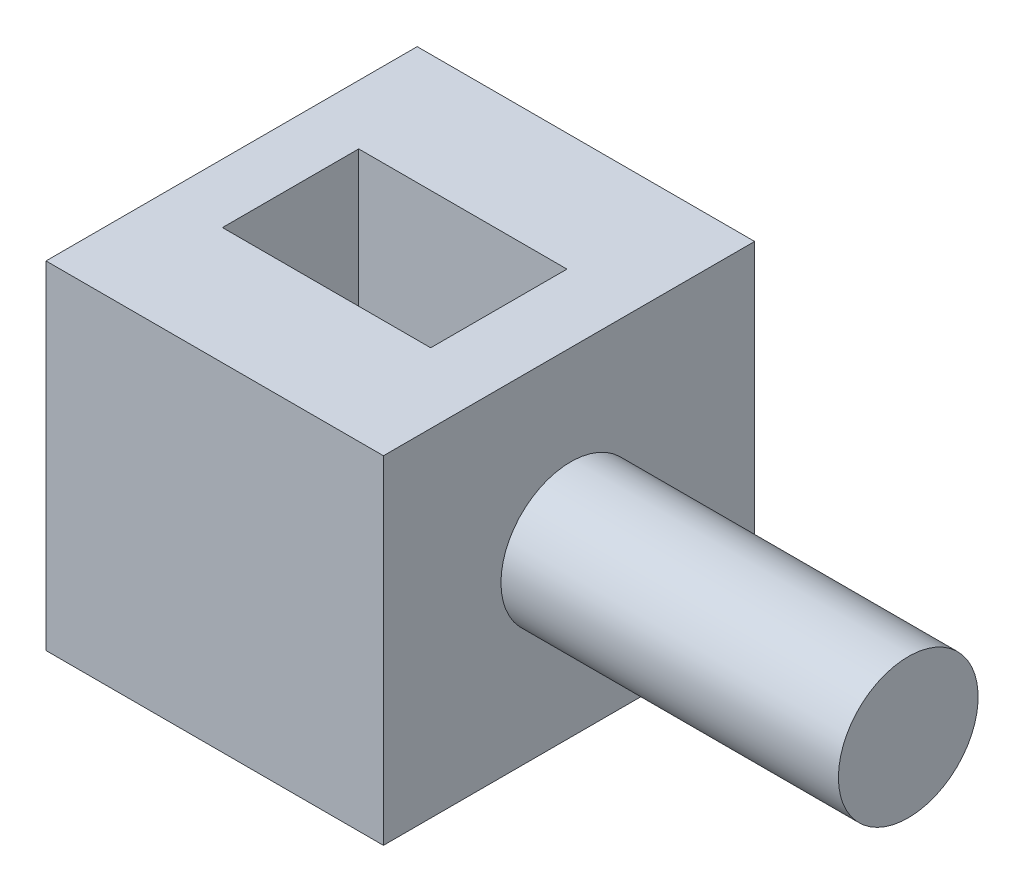
from build123d import *

# Parameters (mm, degrees)
BOSS_EXTRUDE1_DEPTH      = 10
BOSS_EXTRUDE1_DEPTH_BACK = 100
SKETCH2_W                = 100
SKETCH2_H                = 100
SKETCH3_R                = 20.704608813
BOSS_EXTRUDE2_DEPTH      = 100
SKETCH4_W                = 61.706837877
SKETCH4_H                = 40.386202863
CUT_EXTRUDE1_DEPTH       = 207.155281281


with BuildPart() as part:
    # Sketch2 → Boss-Extrude1 (new, two sides: drawn at the far end of the back side and taken through both)
    with BuildSketch(Plane.XY.offset(-BOSS_EXTRUDE1_DEPTH_BACK)):
        Rectangle(SKETCH2_W, SKETCH2_H)
    extrude(amount=BOSS_EXTRUDE1_DEPTH + BOSS_EXTRUDE1_DEPTH_BACK)

    # Sketch3 → Boss-Extrude2 (add)
    with BuildSketch(Plane(origin=(50, 0, 0), x_dir=(0, 0, -1), z_dir=(1, 0, 0))):
        with Locations(Location((45.530604039, 0, 0), (0, 0, 180))):
            Circle(SKETCH3_R)
    extrude(amount=BOSS_EXTRUDE2_DEPTH)

    # Sketch4 → Cut-Extrude1 (cut, through all)
    with BuildSketch(Plane(origin=(0, 50, 0), x_dir=(1, 0, 0), z_dir=(0, 1, 0))):
        with Locations((-1.559035635, 44.897496948)):
            Rectangle(SKETCH4_W, SKETCH4_H)
    extrude(amount=-CUT_EXTRUDE1_DEPTH, mode=Mode.SUBTRACT)


solid = part.part
